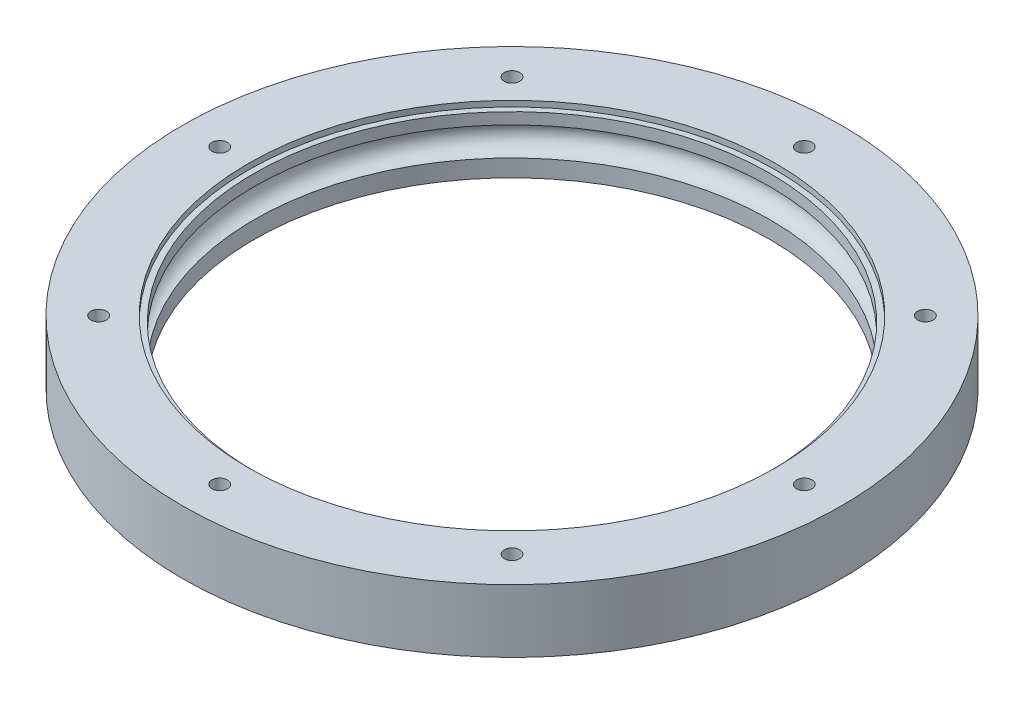
from build123d import *

# Parameters (mm, degrees)
SKETCH2_W          = 11.5
SKETCH2_H          = 1
SKETCH3_R          = 1.35
CUT_EXTRUDE1_DEPTH = 83.057906383


with BuildPart() as part:
    # Sketch2 → Revolve1 (revolve)
    with BuildSketch(Plane.XY, mode=Mode.PRIVATE) as revolve1_sk:
        with Locations((-51.75, 10.5)):
            Rectangle(SKETCH2_W, SKETCH2_H)
        with BuildLine():
            Line((-45, 8), (-45, 10))
            Line((-45, 10), (-46, 10))
            Line((-46, 10), (-57.5, 10))
            Line((-57.5, 10), (-57.5, 0))
            Line((-57.5, 0), (-45, 0))
            Line((-45, 0), (-45, 3))
            ThreePointArc((-45, 3), (-47.5, 5.5), (-45, 8))
        make_face()
    revolve(revolve1_sk.sketch.rotate(Axis((0, 0, 0), (0, 1, 0)), 270), axis=Axis((0, 0, 0), (0, 1, 0)))

    # Sketch3 → Cut-Extrude1 (cut, through all)
    with BuildSketch(Plane(origin=(0, 11, 0), x_dir=(1, 0, 0), z_dir=(0, 1, 0))):
        with Locations(Location((-36.062445841, -36.062445841, 0), (0, 0, 270))):
            Circle(SKETCH3_R)
        with Locations(Location((0, -51, 0), (0, 0, 270))):
            Circle(SKETCH3_R)
        with Locations(Location((36.062445841, -36.062445841, 0), (0, 0, 270))):
            Circle(SKETCH3_R)
        with Locations(Location((51, 0, 0), (0, 0, 270))):
            Circle(SKETCH3_R)
        with Locations(Location((36.062445841, 36.062445841, 0), (0, 0, 270))):
            Circle(SKETCH3_R)
        with Locations(Location((0, 51, 0), (0, 0, 270))):
            Circle(SKETCH3_R)
        with Locations(Location((-36.062445841, 36.062445841, 0), (0, 0, 270))):
            Circle(SKETCH3_R)
        with Locations(Location((-51, 0, 0), (0, 0, 270))):
            Circle(SKETCH3_R)
    extrude(amount=-CUT_EXTRUDE1_DEPTH, mode=Mode.SUBTRACT)


solid = part.part
